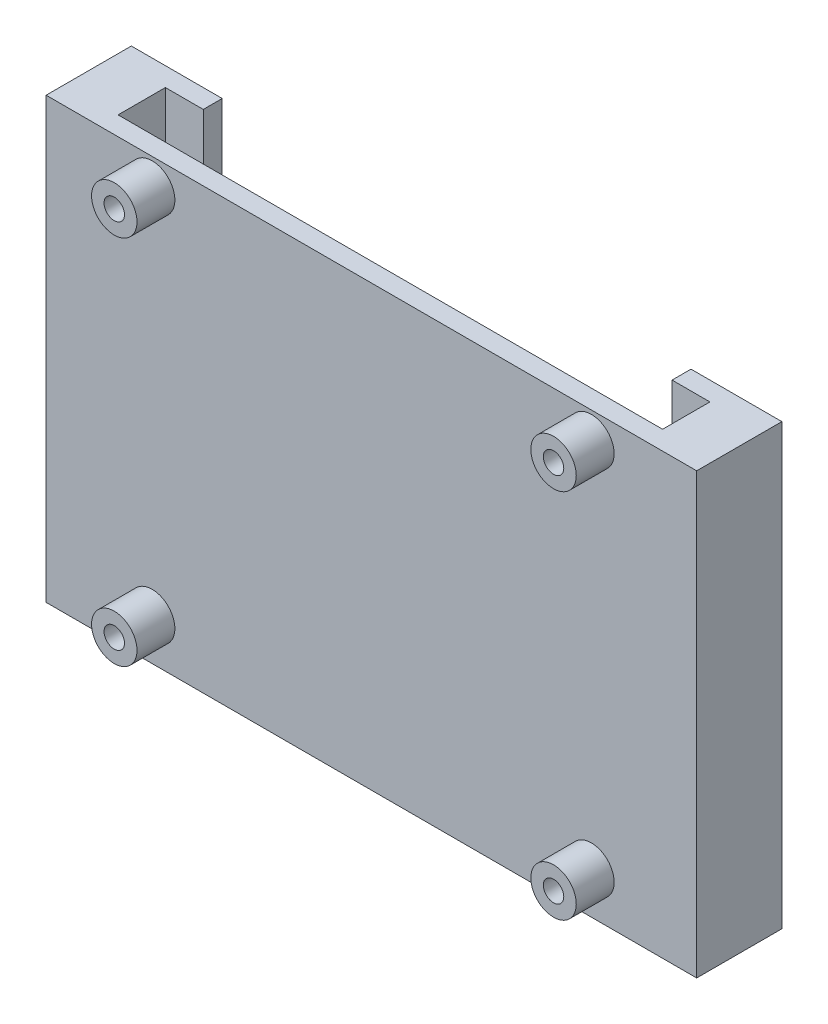
from build123d import *

# Parameters (mm, degrees)
SKETCH1_W              = 85.9
SKETCH1_H              = 58
BOSS_EXTRUDE1_DEPTH    = 2.5
SKETCH2_R              = 3
BOSS_EXTRUDE2_DEPTH    = 5
LPATTERN1_COUNT        = 2
LPATTERN1_PITCH        = 49
M2_5_CLEARANCE_HOLE1_D = 2.7
SKETCH6_W              = 7
SKETCH6_H              = 58
BOSS_EXTRUDE3_DEPTH    = 8.75
SKETCH7_W              = 2.5
SKETCH7_H              = 58
BOSS_EXTRUDE4_DEPTH    = 5
SKETCH8_W              = 2.5
SKETCH8_H              = 58
BOSS_EXTRUDE5_DEPTH    = 5
SKETCH9_R              = 3.15
CUT_EXTRUDE1_DEPTH     = 2.7


with BuildPart() as part:
    # Sketch1 → Boss-Extrude1 (new body)
    with BuildSketch(Plane.XY):
        Rectangle(SKETCH1_W, SKETCH1_H)
    extrude(amount=BOSS_EXTRUDE1_DEPTH)

    # Sketch2 → Boss-Extrude2 (add)
    with BuildSketch(Plane.XY.offset(2.5)):
        with Locations(Location((-28.95, 25.5, 0), (0, 0, 180))):
            Circle(SKETCH2_R)
        with Locations(Location((29.05, 25.5, 0), (0, 0, 180))):
            Circle(SKETCH2_R)
    boss_extrude2 = extrude(amount=BOSS_EXTRUDE2_DEPTH)

    # LPattern1: Boss-Extrude2 ×2
    with Locations(*[(0, -i * LPATTERN1_PITCH, 0) for i in range(1, LPATTERN1_COUNT)]):
        add(boss_extrude2)

    # M2.5 Clearance Hole1 (through all)
    with Locations(Plane.XY.offset(7.5)):
        with Locations((-28.95, 25.5), (-28.95, -23.5), (29.05, 25.5), (29.05, -23.5)):
            Hole(M2_5_CLEARANCE_HOLE1_D / 2)

    # Sketch6 → Boss-Extrude3 (add)
    with BuildSketch(Plane(origin=(0, 0, 0), x_dir=(-1, 0, 0), z_dir=(0, 0, -1))):
        with Locations((-39.45, 0)):
            Rectangle(SKETCH6_W, SKETCH6_H)
        with Locations((39.45, 0)):
            Rectangle(SKETCH6_W, SKETCH6_H)
    extrude(amount=BOSS_EXTRUDE3_DEPTH)

    # Sketch7 → Boss-Extrude4 (add)
    with BuildSketch(Plane.ZY.offset(-35.95)):
        with Locations((-7.5, 0)):
            Rectangle(SKETCH7_W, SKETCH7_H)
    extrude(amount=BOSS_EXTRUDE4_DEPTH)

    # Sketch8 → Boss-Extrude5 (add)
    with BuildSketch(Plane(origin=(-35.95, 0, 0), x_dir=(0, 0, -1), z_dir=(1, 0, 0))):
        with Locations((7.5, 0)):
            Rectangle(SKETCH8_W, SKETCH8_H)
    extrude(amount=BOSS_EXTRUDE5_DEPTH)

    # Sketch9 → Cut-Extrude1 (cut)
    with BuildSketch(Plane.XZ.offset(29)):
        with Locations(Location((-39.45, -3.125, 0), (0, 0, 270))):
            Circle(SKETCH9_R)
        with Locations(Location((39.45, -3.125, 0), (0, 0, 270))):
            Circle(SKETCH9_R)
    extrude(amount=-CUT_EXTRUDE1_DEPTH, mode=Mode.SUBTRACT)


solid = part.part
